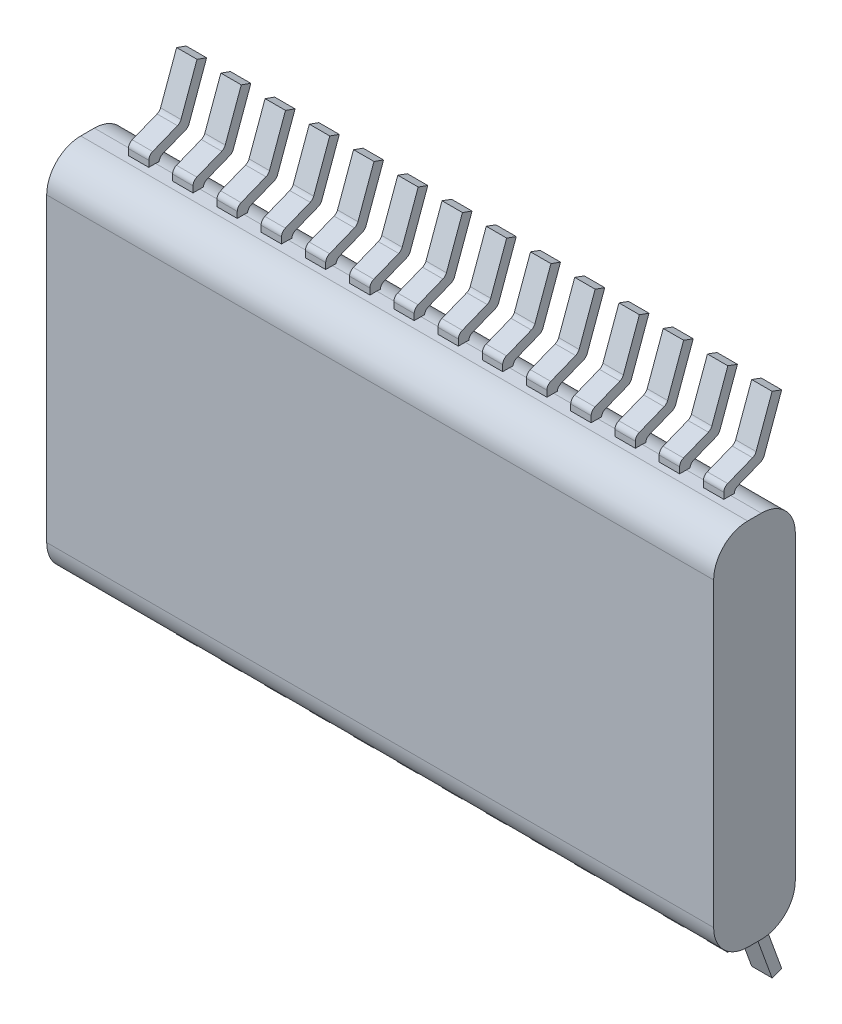
from build123d import *

# Parameters (mm, degrees)
SKETCH1_W             = 9.8
SKETCH1_H             = 5.423830735
BOSS_EXTRUDE1_DEPTH   = 1.2
FILLET1_R             = 0.5
BOSS_EXTRUDE2_START   = -0.45
BOSS_EXTRUDE2_DEPTH   = 0.3
BOSS_EXTRUDE2_2_DEPTH = 0.3
LPATTERN1_COUNT       = 14
LPATTERN1_PITCH       = 0.65


with BuildPart() as part:
    # Sketch1 → Boss-Extrude1 (new body)
    with BuildSketch(Plane.XY):
        with Locations((4.9, 2.711915368)):
            Rectangle(SKETCH1_W, SKETCH1_H)
    extrude(amount=BOSS_EXTRUDE1_DEPTH)

    # Fillet1
    fillet1_edges = [part.edges().sort_by_distance(p)[0] for p in [
        (4.9, 5.423830735, 1.2),
        (4.9, 5.423830735, 0),
        (4.9, 0, 0),
        (4.9, 0, 1.2),
    ]]
    fillet(fillet1_edges, radius=FILLET1_R)


with BuildPart() as body_2:
    # Sketch2 → Boss-Extrude2 (new body)
    with BuildSketch(Plane(origin=(9.8, 0, 0), x_dir=(0, 0, -1), z_dir=(1, 0, 0)).offset(BOSS_EXTRUDE2_START)):
        with BuildLine():
            Line((-0.6, 0), (-0.6, -0.089810348))
            ThreePointArc((-0.6, -0.089810348), (-0.584499319, -0.140306401), (-0.543336636, -0.173408606))
            Line((-0.543336636, -0.173408606), (-0.177916209, -0.319128001))
            ThreePointArc((-0.177916209, -0.319128001), (-0.146632785, -0.340082441), (-0.126659795, -0.372001415))
            Line((-0.126659795, -0.372001415), (0.109011585, -1.020862655))
            Line((0.109011585, -1.020862655), (0.25, -0.969654581))
            Line((0.25, -0.969654581), (-0.008630364, -0.257581616))
            ThreePointArc((-0.008630364, -0.257581616), (-0.028603353, -0.225662643), (-0.059886777, -0.204708202))
            Line((-0.059886777, -0.204708202), (-0.391470983, -0.072481741))
            ThreePointArc((-0.391470983, -0.072481741), (-0.4301998, -0.042796103), (-0.447743524, 0.002738237))
            ThreePointArc((-0.447743524, 0.002738237), (-0.473835915, 0.000685029), (-0.5, 0))
            Line((-0.5, 0), (-0.6, 0))
        make_face()
    boss_extrude2 = extrude(amount=-BOSS_EXTRUDE2_DEPTH)


with BuildPart() as body_3:
    # Sketch2 → Boss-Extrude2 2 (new body)
    with BuildSketch(Plane(origin=(9.8, 0, 0), x_dir=(0, 0, -1), z_dir=(1, 0, 0)).offset(BOSS_EXTRUDE2_START)):
        with BuildLine():
            Line((-0.6, 5.423830735), (-0.5, 5.423830735))
            ThreePointArc((-0.5, 5.423830735), (-0.473835915, 5.423145706), (-0.447743524, 5.421092498))
            ThreePointArc((-0.447743524, 5.421092498), (-0.4301998, 5.466626838), (-0.391470983, 5.496312476))
            Line((-0.391470983, 5.496312476), (-0.059886777, 5.628538937))
            ThreePointArc((-0.059886777, 5.628538937), (-0.028603353, 5.649493377), (-0.008630364, 5.681412351))
            Line((-0.008630364, 5.681412351), (0.25, 6.393485316))
            Line((0.25, 6.393485316), (0.109011585, 6.44469339))
            Line((0.109011585, 6.44469339), (-0.126659795, 5.79583215))
            ThreePointArc((-0.126659795, 5.79583215), (-0.146632785, 5.763913176), (-0.177916209, 5.742958736))
            Line((-0.177916209, 5.742958736), (-0.543336636, 5.597239341))
            ThreePointArc((-0.543336636, 5.597239341), (-0.584499319, 5.564137136), (-0.6, 5.513641083))
            Line((-0.6, 5.513641083), (-0.6, 5.423830735))
        make_face()
    boss_extrude2_2 = extrude(amount=-BOSS_EXTRUDE2_2_DEPTH)


with BuildPart() as lpattern1_1:
    # LPattern1: Boss-Extrude2, Boss-Extrude2 2 ×14
    with Locations(*[(-i * LPATTERN1_PITCH, 0, 0) for i in range(1, LPATTERN1_COUNT)]):
        add(boss_extrude2)
        add(boss_extrude2_2)


solid = Compound([part.part, body_2.part, body_3.part, lpattern1_1.part])
